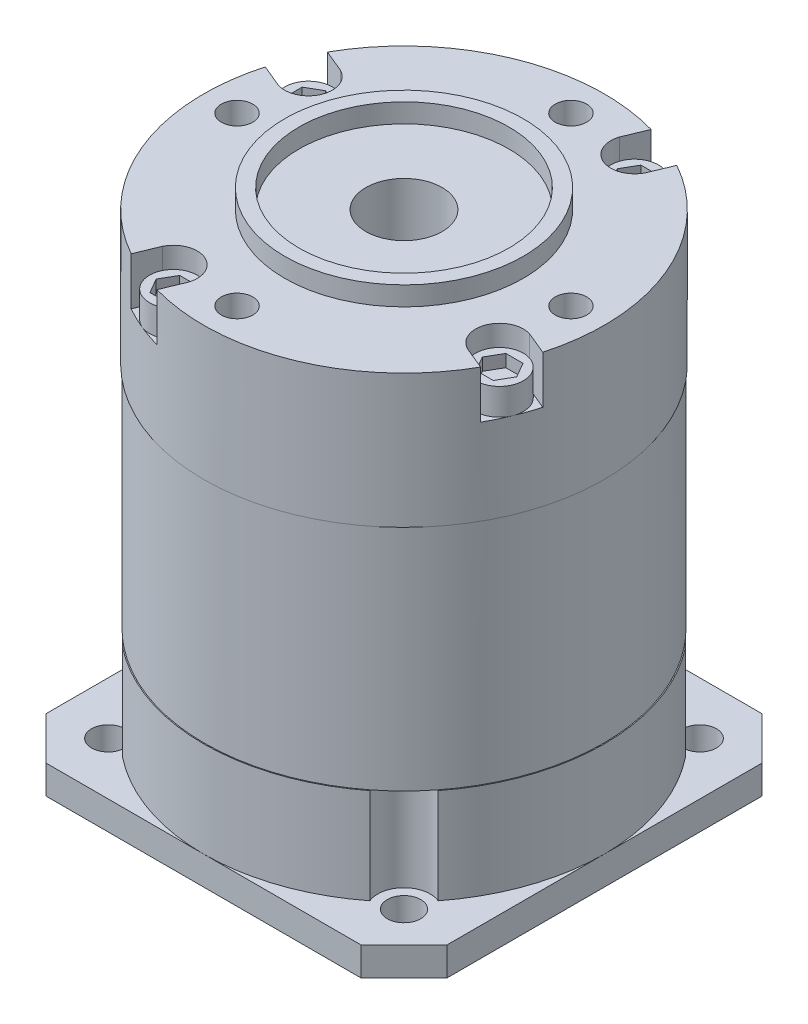
from build123d import *

# Parameters (mm, degrees)
SKETCH_1_W             = 42
SKETCH_1_H             = 42
EXTRUDE_1_DEPTH        = 3
CUT_EXTRUDE_START      = 3
CUT_EXTRUDE_1_DEPTH    = 3
SKETCH_3_R             = 21
EXTRUDE_2_DEPTH        = 51
SKETCH_5_R             = 1.75
CUT_EXTRUDE_3_DEPTH    = 3
SKETCH_7_R             = 2.75
CUT_EXTRUDE_4_DEPTH    = 10
CUT_EXTRUDE_START_2    = 13
SKETCH_8_R             = 21
SKETCH_8_R_2           = 20.9
CUT_EXTRUDE_5_DEPTH    = 24
EXTRUDE_START          = 51
SKETCH_9_R             = 12.5
EXTRUDE_3_DEPTH        = 2
CUT_EXTRUDE_START_3    = 53
SKETCH_16_R            = 11
CUT_EXTRUDE_6_DEPTH    = 2
CUT_EXTRUDE_START_4    = 46
CUT_EXTRUDE_7_DEPTH    = 5
EXTRUDE_START_2        = 46
SKETCH_18_R            = 2.5
EXTRUDE_5_DEPTH        = 2.8
SKETCH_19_R            = 4
CUT_EXTRUDE_8_DEPTH    = 51
EXTRUDE_6_DEPTH        = 1.5
SKETCH_21_R            = 12.5
CUT_EXTRUDE_9_DEPTH    = 3
HOLE_WIZARD_M4_1_D     = 3.3
HOLE_WIZARD_M4_1_DEPTH = 10.1
HOLE_WIZARD_M4_1_TIP   = 0.991420021


with BuildPart() as part:
    # 草图1 → 凸台-拉伸1 (new body)
    with BuildSketch(Plane(origin=(0, 0, 0), x_dir=(1, 0, 0), z_dir=(0, 1, 0))):
        Rectangle(SKETCH_1_W, SKETCH_1_H)
    extrude(amount=EXTRUDE_1_DEPTH)

    # 草图2 → 切除-拉伸1 (cut)
    with BuildSketch(Plane(origin=(0, 0, 0), x_dir=(1, 0, 0), z_dir=(0, 1, 0)).offset(CUT_EXTRUDE_START)):
        Polygon((-21, 21), (-21, 16.5), (-16.5, 21), align=None)
        Polygon((16.5, 21), (21, 21), (21, 16.5), align=None)
        Polygon((21, -21), (21, -16.5), (16.5, -21), align=None)
        Polygon((-16.5, -21), (-21, -21), (-21, -16.5), align=None)
    extrude(amount=-CUT_EXTRUDE_1_DEPTH, mode=Mode.SUBTRACT)

    # 草图3 → 凸台-拉伸2 (add)
    with BuildSketch(Plane(origin=(0, 0, 0), x_dir=(1, 0, 0), z_dir=(0, 1, 0))):
        with Locations(Location((0, 0, 0), (0, 0, 270))):
            Circle(SKETCH_3_R)
    extrude(amount=EXTRUDE_2_DEPTH)

    # 草图5 → 切除-拉伸3 (cut)
    with BuildSketch(Plane(origin=(0, 0, 0), x_dir=(1, 0, 0), z_dir=(0, 1, 0))):
        with Locations(Location((-15.5, 15.5, 0), (0, 0, 11.30517652))):
            Circle(SKETCH_5_R)
        with Locations(Location((15.5, 15.5, 0), (0, 0, 168.69482348))):
            Circle(SKETCH_5_R)
        with Locations(Location((-15.5, -15.5, 0), (0, 0, 101.30517652))):
            Circle(SKETCH_5_R)
        with Locations(Location((15.5, -15.5, 0), (0, 0, 78.69482348))):
            Circle(SKETCH_5_R)
    extrude(amount=CUT_EXTRUDE_3_DEPTH, mode=Mode.SUBTRACT)

    # 草图7 → 切除-拉伸4 (cut)
    with BuildSketch(Plane(origin=(0, 0, 0), x_dir=(1, 0, 0), z_dir=(0, 1, 0)).offset(CUT_EXTRUDE_START)):
        with Locations((-15.5, 15.5)):
            Circle(SKETCH_7_R)
        with Locations((15.5, 15.5)):
            Circle(SKETCH_7_R)
        with Locations((-15.5, -15.5)):
            Circle(SKETCH_7_R)
        with Locations((15.5, -15.5)):
            Circle(SKETCH_7_R)
    extrude(amount=CUT_EXTRUDE_4_DEPTH, mode=Mode.SUBTRACT)

    # 草图8 → 切除-拉伸5 (cut)
    with BuildSketch(Plane(origin=(0, 0, 0), x_dir=(1, 0, 0), z_dir=(0, 1, 0)).offset(CUT_EXTRUDE_START_2)):
        with Locations(Location((0, 0, 0), (0, 0, 270))):
            Circle(SKETCH_8_R)
        with Locations(Location((0, 0, 0), (0, 0, 51.840009715))):
            Circle(SKETCH_8_R_2, mode=Mode.SUBTRACT)
    extrude(amount=CUT_EXTRUDE_5_DEPTH, mode=Mode.SUBTRACT)

    # 草图9 → 凸台-拉伸3 (add)
    with BuildSketch(Plane(origin=(0, 0, 0), x_dir=(1, 0, 0), z_dir=(0, 1, 0)).offset(EXTRUDE_START)):
        with Locations(Location((0, 0, 0), (0, 0, 270))):
            Circle(SKETCH_9_R)
    extrude(amount=EXTRUDE_3_DEPTH)

    # 草图16 → 切除-拉伸6 (cut)
    with BuildSketch(Plane(origin=(0, 0, 0), x_dir=(1, 0, 0), z_dir=(0, 1, 0)).offset(CUT_EXTRUDE_START_3)):
        with Locations(Location((0, 0, 0), (0, 0, 270))):
            Circle(SKETCH_16_R)
    extrude(amount=-CUT_EXTRUDE_6_DEPTH, mode=Mode.SUBTRACT)

    # 草图17 → 切除-拉伸7 (cut)
    with BuildSketch(Plane(origin=(0, 0, 0), x_dir=(1, 0, 0), z_dir=(0, 1, 0)).offset(CUT_EXTRUDE_START_4)):
        with BuildLine():
            Line((16.293309868, -9.448706448), (18.309607443, -10.28388425))
            ThreePointArc((18.309607443, -10.28388425), (19.401470183, -8.03635208), (20.218651874, -5.675043294))
            Line((20.218651874, -5.675043294), (18.202354299, -4.839865492))
            Line((18.202354299, -4.839865492), (17.890232835, -4.710580549))
            ThreePointArc((17.890232835, -4.710580549), (14.78207252, -6.122934918), (15.981188404, -9.319421505))
            Line((15.981188404, -9.319421505), (16.293309868, -9.448706448))
        make_face()
        with BuildLine():
            Line((-4.839865492, -18.202354299), (-4.710580549, -17.890232835))
            ThreePointArc((-4.710580549, -17.890232835), (-6.122934918, -14.78207252), (-9.319421505, -15.981188404))
            Line((-9.319421505, -15.981188404), (-9.448706448, -16.293309868))
            Line((-9.448706448, -16.293309868), (-10.28388425, -18.309607443))
            ThreePointArc((-10.28388425, -18.309607443), (-8.03635208, -19.401470183), (-5.675043294, -20.218651874))
            Line((-5.675043294, -20.218651874), (-4.839865492, -18.202354299))
        make_face()
        with BuildLine():
            Line((-16.293309868, 9.448706448), (-18.309607443, 10.28388425))
            ThreePointArc((-18.309607443, 10.28388425), (-19.401470183, 8.03635208), (-20.218651874, 5.675043294))
            Line((-20.218651874, 5.675043294), (-18.202354299, 4.839865492))
            Line((-18.202354299, 4.839865492), (-17.890232835, 4.710580549))
            ThreePointArc((-17.890232835, 4.710580549), (-14.78207252, 6.122934918), (-15.981188404, 9.319421505))
            Line((-15.981188404, 9.319421505), (-16.293309868, 9.448706448))
        make_face()
        with BuildLine():
            Line((4.839865492, 18.202354299), (4.710580549, 17.890232835))
            ThreePointArc((4.710580549, 17.890232835), (6.122934918, 14.78207252), (9.319421505, 15.981188404))
            Line((9.319421505, 15.981188404), (9.448706448, 16.293309868))
            Line((9.448706448, 16.293309868), (10.28388425, 18.309607443))
            ThreePointArc((10.28388425, 18.309607443), (8.03635208, 19.401470183), (5.675043294, 20.218651874))
            Line((5.675043294, 20.218651874), (4.839865492, 18.202354299))
        make_face()
    extrude(amount=CUT_EXTRUDE_7_DEPTH, mode=Mode.SUBTRACT)

    # 草图18 → 凸台-拉伸5 (add)
    # profile 1 of 4: a face of its own
    with BuildSketch(Plane(origin=(0, 0, 0), x_dir=(1, 0, 0), z_dir=(0, 1, 0)).offset(EXTRUDE_START_2)):
        with Locations((-17.091771351, 7.079643499)):
            Circle(SKETCH_18_R)
        Polygon((-15.532925625, 7.979643499), (-17.091771351, 8.879643499), (-18.650617078, 7.979643499), (-18.650617078, 6.179643499), (-17.091771351, 5.279643499), (-15.532925625, 6.179643499), align=None, mode=Mode.SUBTRACT)
    # profile 2 of 4: a face of its own
    with BuildSketch(Plane(origin=(0, 0, 0), x_dir=(1, 0, 0), z_dir=(0, 1, 0)).offset(EXTRUDE_START_2)):
        with Locations((-7.079643499, -17.091771351)):
            Circle(SKETCH_18_R)
        Polygon((-6.179643499, -18.650617078), (-5.279643499, -17.091771351), (-6.179643499, -15.532925625), (-7.979643499, -15.532925625), (-8.879643499, -17.091771351), (-7.979643499, -18.650617078), align=None, mode=Mode.SUBTRACT)
    # profile 3 of 4: a face of its own
    with BuildSketch(Plane(origin=(0, 0, 0), x_dir=(1, 0, 0), z_dir=(0, 1, 0)).offset(EXTRUDE_START_2)):
        with Locations((17.091771351, -7.079643499)):
            Circle(SKETCH_18_R)
        Polygon((18.891771351, -7.079643499), (17.991771351, -5.520797772), (16.191771351, -5.520797772), (15.291771351, -7.079643499), (16.191771351, -8.638489226), (17.991771351, -8.638489226), align=None, mode=Mode.SUBTRACT)
    # profile 4 of 4: a face of its own
    with BuildSketch(Plane(origin=(0, 0, 0), x_dir=(1, 0, 0), z_dir=(0, 1, 0)).offset(EXTRUDE_START_2)):
        with Locations((7.079643499, 17.091771351)):
            Circle(SKETCH_18_R)
        Polygon((7.979643499, 15.532925625), (8.879643499, 17.091771351), (7.979643499, 18.650617078), (6.179643499, 18.650617078), (5.279643499, 17.091771351), (6.179643499, 15.532925625), align=None, mode=Mode.SUBTRACT)
    extrude(amount=EXTRUDE_5_DEPTH)

    # 草图19 → 切除-拉伸8 (cut)
    with BuildSketch(Plane(origin=(0, 0, 0), x_dir=(1, 0, 0), z_dir=(0, 1, 0))):
        with Locations(Location((0, 0, 0), (0, 0, 270))):
            Circle(SKETCH_19_R)
    extrude(amount=CUT_EXTRUDE_8_DEPTH, mode=Mode.SUBTRACT)

    # 草图20 → 凸台-拉伸6 (add)
    with BuildSketch(Plane(origin=(0, 0, 0), x_dir=(1, 0, 0), z_dir=(0, 1, 0)).offset(EXTRUDE_START_2)):
        Polygon((7.979643499, 18.650617078), (6.179643499, 18.650617078), (5.279643499, 17.091771351), (6.179643499, 15.532925625), (7.979643499, 15.532925625), (8.879643499, 17.091771351), align=None)
        Polygon((16.191771351, -5.520797772), (15.291771351, -7.079643499), (16.191771351, -8.638489226), (17.991771351, -8.638489226), (18.891771351, -7.079643499), (17.991771351, -5.520797772), align=None)
        Polygon((-6.179643499, -15.532925625), (-7.979643499, -15.532925625), (-8.879643499, -17.091771351), (-7.979643499, -18.650617078), (-6.179643499, -18.650617078), (-5.279643499, -17.091771351), align=None)
        Polygon((-18.650617078, 7.979643499), (-18.650617078, 6.179643499), (-17.091771351, 5.279643499), (-15.532925625, 6.179643499), (-15.532925625, 7.979643499), (-17.091771351, 8.879643499), align=None)
    extrude(amount=EXTRUDE_6_DEPTH)

    # 草图21 → 切除-拉伸9 (cut)
    with BuildSketch(Plane(origin=(0, 0, 0), x_dir=(1, 0, 0), z_dir=(0, 1, 0))):
        with Locations(Location((0, 0, 0), (0, 0, 270))):
            Circle(SKETCH_21_R)
    extrude(amount=CUT_EXTRUDE_9_DEPTH, mode=Mode.SUBTRACT)

    # M4 螺纹孔1
    with Locations(Plane(origin=(0, 51, 0), x_dir=(1, 0, 0), z_dir=(0, 1, 0))):
        with Locations((0, 17.5), (-17.5, 0), (17.5, 0), (0, -17.5)):
            Hole(HOLE_WIZARD_M4_1_D / 2, depth=HOLE_WIZARD_M4_1_DEPTH)
            with Locations((0, 0, -(HOLE_WIZARD_M4_1_DEPTH + HOLE_WIZARD_M4_1_TIP / 2))):  # 118° drill point
                Cone(0, HOLE_WIZARD_M4_1_D / 2, HOLE_WIZARD_M4_1_TIP, mode=Mode.SUBTRACT)


solid = part.part
